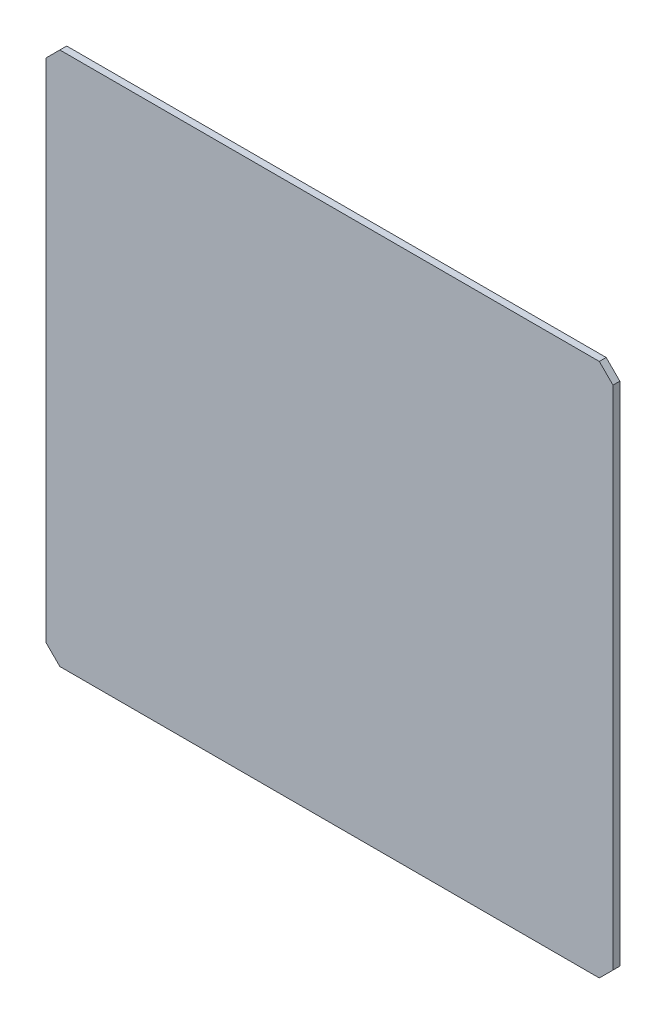
from build123d import *

# Parameters (mm, degrees)
ESTRUSIONE_ESTRUSIONE1_DEPTH = 5


with BuildPart() as part:
    # Schizzo1 → Estrusione-Estrusione1 (new body)
    with BuildSketch(Plane.XY):
        Polygon((-207, 185), (-197, 195), (197, 195), (207, 185), (207, -185), (197, -195), (-197, -195), (-207, -185), align=None)
    extrude(amount=ESTRUSIONE_ESTRUSIONE1_DEPTH)


solid = part.part
